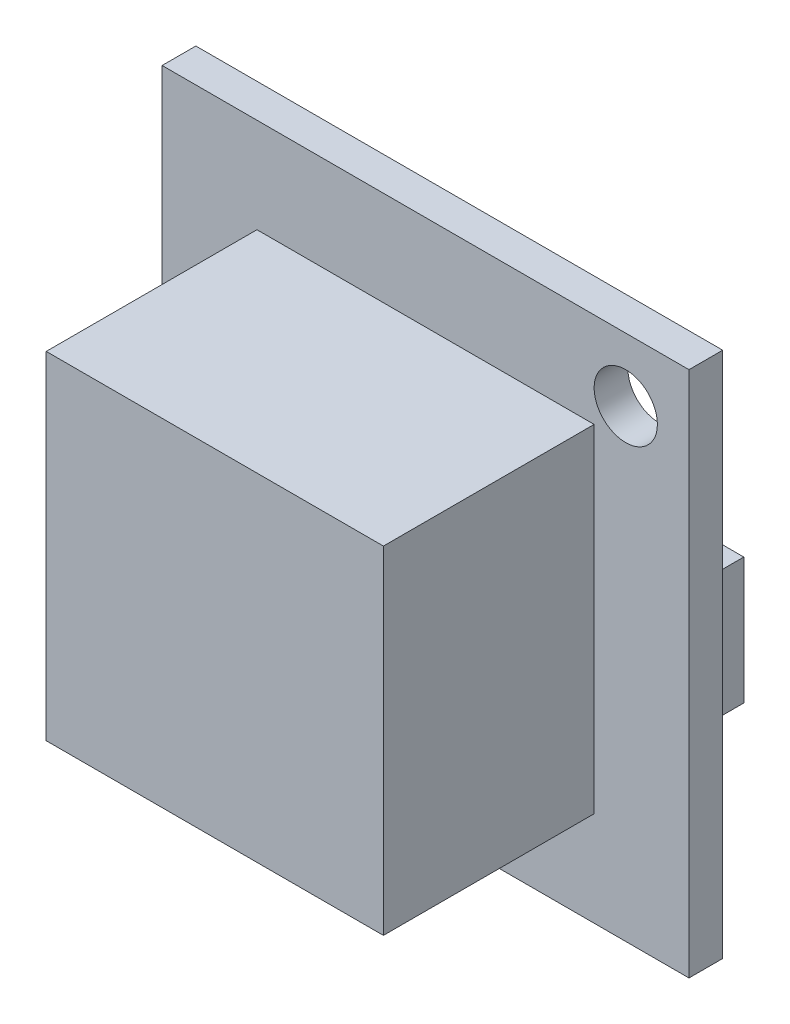
from build123d import *

# Parameters (mm, degrees)
SKETCH1_W           = 25
SKETCH1_H           = 25
BOSS_EXTRUDE1_DEPTH = 1.6
SKETCH2_R           = 1.5
CUT_EXTRUDE1_DEPTH  = 18.749929577
SKETCH3_W           = 16
SKETCH3_H           = 16
BOSS_EXTRUDE2_DEPTH = 10
SKETCH4_W           = 7
SKETCH4_H           = 5
BOSS_EXTRUDE3_DEPTH = 8
SKETCH5_W           = 6
SKETCH5_H           = 6
BOSS_EXTRUDE4_DEPTH = 2


with BuildPart() as part:
    # Sketch1 → Boss-Extrude1 (new body)
    with BuildSketch(Plane.XY):
        Rectangle(SKETCH1_W, SKETCH1_H)
    extrude(amount=BOSS_EXTRUDE1_DEPTH)

    # Sketch2 → Cut-Extrude1 (cut, through all)
    with BuildSketch(Plane.XY.offset(1.6)):
        with Locations((9.5, 9.5)):
            Circle(SKETCH2_R)
        with Locations((-9.5, -9.5)):
            Circle(SKETCH2_R)
    extrude(amount=-CUT_EXTRUDE1_DEPTH, mode=Mode.SUBTRACT)

    # Sketch3 → Boss-Extrude2 (add)
    with BuildSketch(Plane.XY.offset(1.6)):
        Rectangle(SKETCH3_W, SKETCH3_H)
    extrude(amount=BOSS_EXTRUDE2_DEPTH)

    # Sketch5 → Boss-Extrude4 (add)
    with BuildSketch(Plane(origin=(0, 0, 0), x_dir=(-1, 0, 0), z_dir=(0, 0, -1))):
        with Locations((-8.5, -0.5)):
            Rectangle(SKETCH5_W, SKETCH5_H)
    extrude(amount=BOSS_EXTRUDE4_DEPTH)


with BuildPart() as body_2:
    # Sketch4 → Boss-Extrude3 (new body)
    with BuildSketch(Plane(origin=(0, 0, 0), x_dir=(-1, 0, 0), z_dir=(0, 0, -1))):
        with Locations((0, -10)):
            Rectangle(SKETCH4_W, SKETCH4_H)
    extrude(amount=BOSS_EXTRUDE3_DEPTH)


solid = Compound([part.part, body_2.part])
